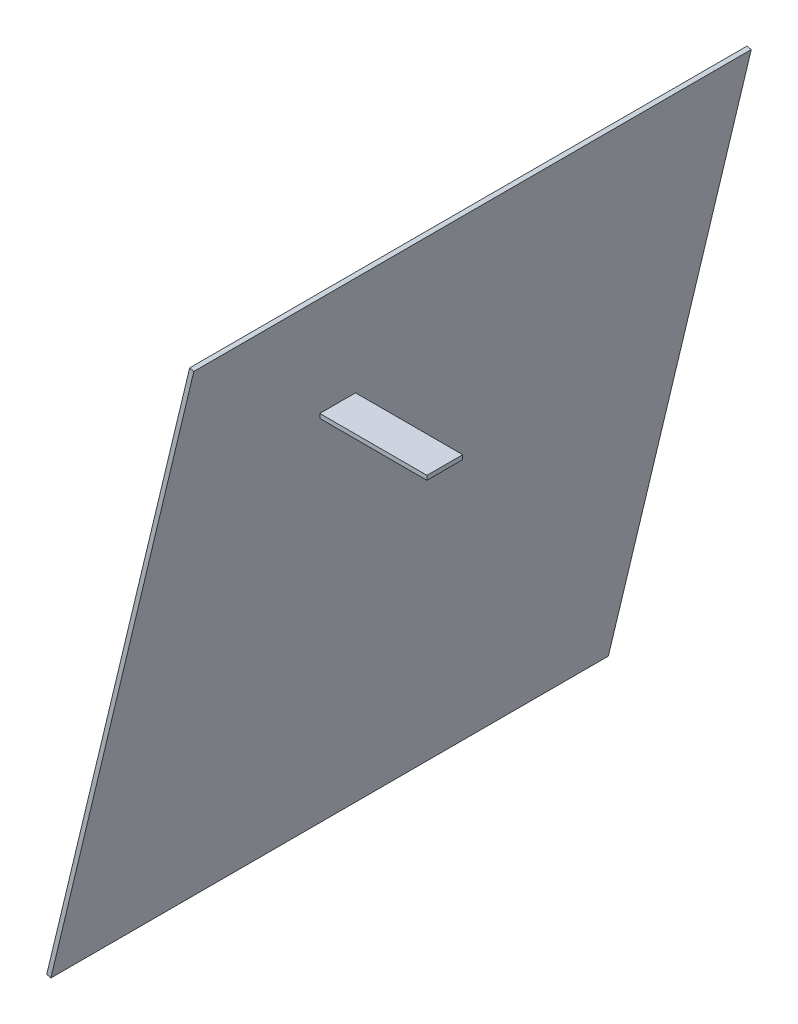
from build123d import *

# Parameters (mm, degrees)
SKETCH4_W           = 390
SKETCH4_H           = 429.328487758
BOSS_EXTRUDE1_DEPTH = 3
SKETCH7_W           = 75
SKETCH7_H           = 25
BOSS_EXTRUDE2_DEPTH = 3


with BuildPart() as part:
    # Sketch4 → Boss-Extrude1 (new body)
    with BuildSketch(Plane(origin=(85.269871504, -20.422942974, 0), x_dir=(0, 0, 1), z_dir=(-0.9724954479051267, 0.23292188347986365, 0))):
        with Locations((-196.0445183, -151.423605962)):
            Rectangle(SKETCH4_W, SKETCH4_H)
    extrude(amount=BOSS_EXTRUDE1_DEPTH)


with BuildPart() as body_2:
    # Sketch7 → Boss-Extrude2 (new body)
    with BuildSketch(Plane.XZ.offset(50.33628258)):
        with Locations((115.605342953, -123.5445183)):
            Rectangle(SKETCH7_W, SKETCH7_H)
    extrude(amount=BOSS_EXTRUDE2_DEPTH)


solid = Compound([part.part, body_2.part])
